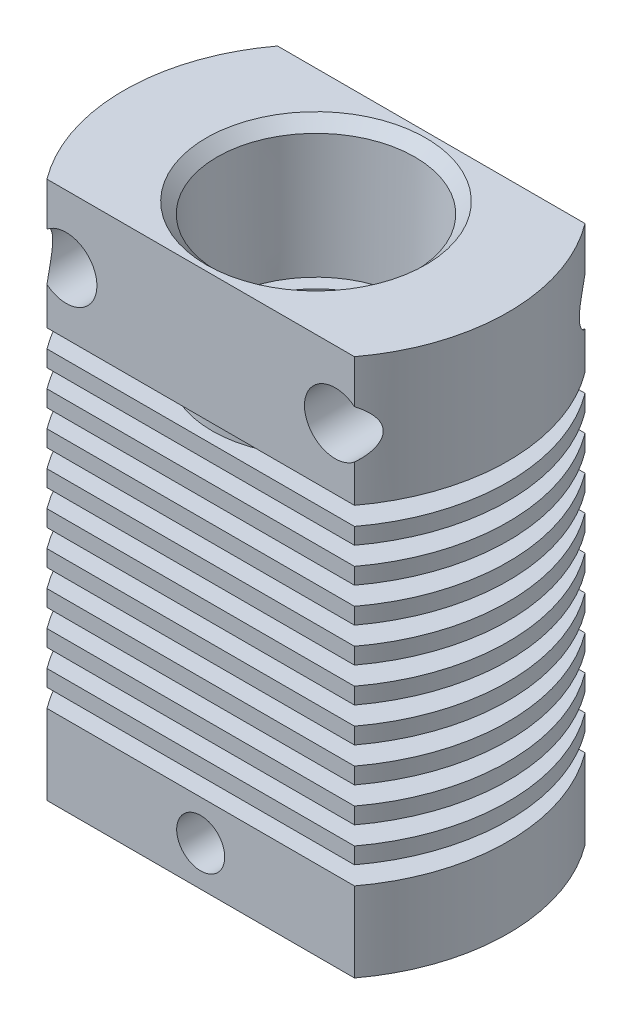
from build123d import *

# Parameters (mm, degrees)
BOSS_EXTRUDE1_DEPTH             = 14
CUT_EXTRUDE1_DEPTH              = 0.95
LPATTERN1_COUNT                 = 10
LPATTERN1_PITCH                 = 1.8
SKETCH3_R                       = 1.6
CUT_EXTRUDE2_DEPTH              = 21.976176963
SKETCH4_R                       = 5.4
BOSS_EXTRUDE2_DEPTH             = 7.65
BOSS_EXTRUDE3_REACH             = 32.332
SKETCH5_R                       = 4.5
SKETCH10_R                      = 2.5
CUT_EXTRUDE6_DEPTH              = 31.331501829
SKETCH9_R                       = 3.5
CUT_EXTRUDE5_DEPTH              = 17
M3X0_5_TAPPED_HOLE1_REACH       = 22.976
M3X0_5_TAPPED_HOLE1_BORE_R      = 1.25
M3X0_5_TAPPED_HOLE2_D           = 2.5
M3X0_5_TAPPED_HOLE2_DEPTH       = 4.15
M3X0_5_TAPPED_HOLE2_CSINK_D     = 3
M3X0_5_TAPPED_HOLE2_CSINK_ANGLE = 90


with BuildPart() as part:
    # Sketch1 → Boss-Extrude1 (new, symmetric)
    with BuildSketch(Plane(origin=(0, 0, 0), x_dir=(1, 0, 0), z_dir=(0, 1, 0))):
        with BuildLine():
            Line((-8, 6), (8, 6))
            ThreePointArc((8, 6), (10, 0), (8, -6))
            Line((8, -6), (-8, -6))
            ThreePointArc((-8, -6), (-10, 0), (-8, 6))
        make_face()
    extrude(amount=BOSS_EXTRUDE1_DEPTH, both=True)

    # Sketch2 → Cut-Extrude1 (cut)
    with BuildSketch(Plane(origin=(0, 7.3, 0), x_dir=(1, 0, 0), z_dir=(0, 1, 0))):
        with BuildLine():
            Line((8, 6), (-8, 6))
            ThreePointArc((-8, 6), (-10, 0), (-8, -6))
            Line((-8, -6), (8, -6))
            ThreePointArc((8, -6), (10, 0), (8, 6))
        make_face()
    cut_extrude1 = extrude(amount=-CUT_EXTRUDE1_DEPTH, mode=Mode.SUBTRACT)


with BuildPart() as cut_extrude1_piece_1:
    # of the separate pieces the step leaves, piece 1, a body of its own (cut_extrude1_pieces)
    add(part.part.solids().sort_by_distance((-8, -14, -6))[0])

    # LPattern1: Cut-Extrude1 ×10
    with Locations(*[(0, -i * LPATTERN1_PITCH, 0) for i in range(1, LPATTERN1_COUNT)]):
        add(cut_extrude1, mode=Mode.SUBTRACT)



with BuildPart() as cut_extrude1_piece_2:
    # of the separate pieces the step leaves, piece 2, a body of its own (cut_extrude1_pieces)
    add(part.part.solids().sort_by_distance((-8, 7.3, -6))[0])

    # Sketch3 → Cut-Extrude2 (cut, through all)
    with BuildSketch(Plane.XY.offset(6)):
        with Locations(Location((7, 10.5, 0), (0, 0, 308.682187453))):
            Circle(SKETCH3_R)
        with Locations(Location((-7, 10.5, 0), (0, 0, 128.682187453))):
            Circle(SKETCH3_R)
    extrude(amount=-CUT_EXTRUDE2_DEPTH, mode=Mode.SUBTRACT)


with BuildPart() as cut_extrude1_piece_1_1:
    add(cut_extrude1_piece_1.part)

    add(cut_extrude1_piece_2.part)  # Boss-Extrude2 merges Cut-Extrude1 piece 2
    # Sketch4 → Boss-Extrude2 (add)
    with BuildSketch(Plane(origin=(0, 14, 0), x_dir=(1, 0, 0), z_dir=(0, 1, 0))):
        with Locations(Location((0, 0, 0), (0, 0, 270))):
            Circle(SKETCH4_R)
    extrude(amount=-BOSS_EXTRUDE2_DEPTH)

    # Boss-Extrude3: up to this face of the body (flat: up to its plane)
    boss_extrude3_end = Plane(cut_extrude1_piece_1_1.part.faces().sort_by_distance((0, -9.85, 0))[0])
    # Sketch5 → Boss-Extrude3 (add, up to the picked face)
    with BuildSketch(Plane(origin=(0, 14, 0), x_dir=(1, 0, 0), z_dir=(0, 1, 0)), mode=Mode.PRIVATE) as boss_extrude3_sk1:
        with Locations(Location((0, 0, 0), (0, 0, 270))):
            Circle(SKETCH5_R)
    boss_extrude3_tool1 = split(extrude(boss_extrude3_sk1.sketch, amount=-BOSS_EXTRUDE3_REACH, mode=Mode.PRIVATE), bisect_by=boss_extrude3_end, keep=Keep.BOTH, mode=Mode.PRIVATE)
    add(boss_extrude3_tool1.solids().sort_by(Axis((0, 14, 0), (0, -1, 0)))[0])

    # Sketch7 → 1/8 NPT Tapped Hole1 (revolve, cut)
    with BuildSketch(Plane(origin=(0, 14, 0), x_dir=(0, 0, 1), z_dir=(1, 0, 0))):
        Polygon((0, 0), (0, 9.633468714), (4.2164, 7.1), (4.2164, 6.92), (4.953294211, 6.92), (5.143373, 0.571627), (5.715, 0), align=None)
    revolve(axis=Axis((0, 20.35, 0), (0, -1, 0)), mode=Mode.SUBTRACT)

    # Sketch10 → Cut-Extrude6 (cut, through all)
    with BuildSketch(Plane(origin=(0, 14, 0), x_dir=(1, 0, 0), z_dir=(0, 1, 0))):
        with Locations(Location((0, 0, 0), (0, 0, 270))):
            Circle(SKETCH10_R)
    extrude(amount=-CUT_EXTRUDE6_DEPTH, mode=Mode.SUBTRACT)

    # Sketch9 → Cut-Extrude5 (cut)
    with BuildSketch(Plane.XZ.offset(14)):
        with Locations(Location((0, 0, 0), (0, 0, 270))):
            Circle(SKETCH9_R)
    extrude(amount=-CUT_EXTRUDE5_DEPTH, mode=Mode.SUBTRACT)

    # M3x0.5 Tapped Hole1 bore → M3x0.5 Tapped Hole1 (cut, up to next)
    with BuildSketch(Plane(origin=(0, 0, 6), x_dir=(-1, 0, 0), z_dir=(0, 0, 1)), mode=Mode.PRIVATE) as m3x0_5_tapped_hole1_sk1:
        with Locations((0, 11.925)):
            Circle(M3X0_5_TAPPED_HOLE1_BORE_R)
    m3x0_5_tapped_hole1_tool1 = extrude(m3x0_5_tapped_hole1_sk1.sketch, amount=-M3X0_5_TAPPED_HOLE1_REACH, mode=Mode.PRIVATE) & cut_extrude1_piece_1_1.part
    add(m3x0_5_tapped_hole1_tool1.solids().sort_by_distance((0, -11.925, 6))[0], mode=Mode.SUBTRACT)

    # M3x0.5 Tapped Hole2
    with Locations(Plane(origin=(0, -14, 0), x_dir=(-1, 0, 0), z_dir=(0, -1, 0))):
        with Locations((6.85970884, 1.7), (-7, 1.7)):
            CounterSinkHole(M3X0_5_TAPPED_HOLE2_D / 2, M3X0_5_TAPPED_HOLE2_CSINK_D / 2, depth=M3X0_5_TAPPED_HOLE2_DEPTH, counter_sink_angle=M3X0_5_TAPPED_HOLE2_CSINK_ANGLE)


solid = cut_extrude1_piece_1_1.part
